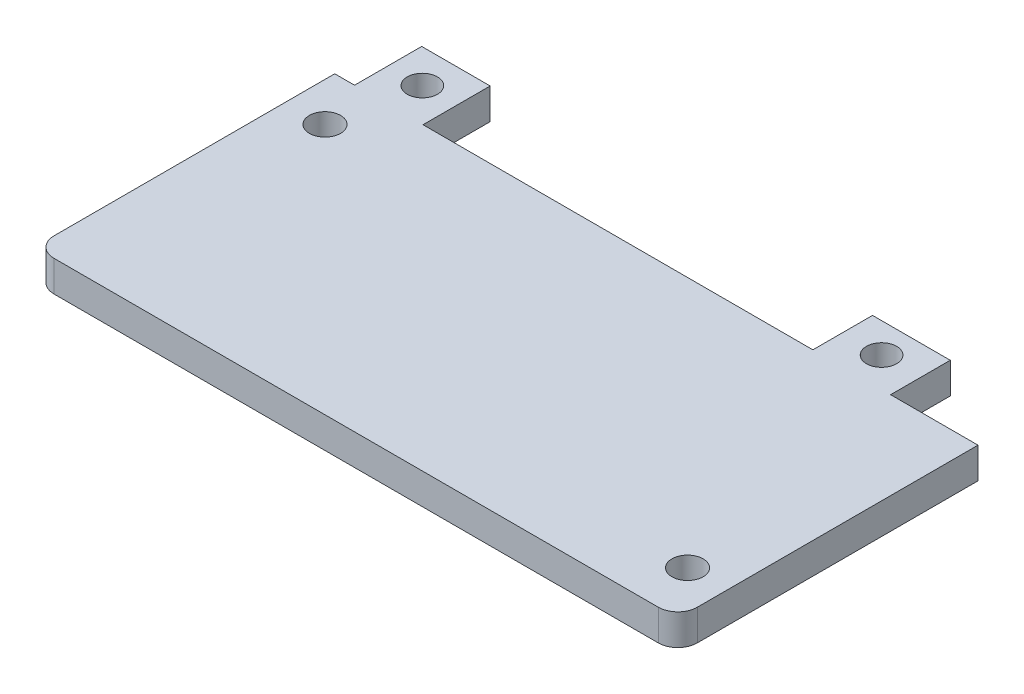
from build123d import *

# Parameters (mm, degrees)
SKETCH2_R           = 1.6
SKETCH2_R_2         = 1.550000008
SKETCH2_R_3         = 1.55
BOSS_EXTRUDE1_DEPTH = 3.175
FILLET1_R           = 2


with BuildPart() as part:
    # Sketch2 → Boss-Extrude1 (new body)
    with BuildSketch(Plane(origin=(0, 0, 0), x_dir=(1, 0, 0), z_dir=(0, 1, 0))):
        Polygon((9.058586069, 30.8), (9.058586069, 37.689356794), (2.033404749, 37.689356794), (2.033404749, 30.8), (0, 30.8), (0, 0), (66, 0), (66, 30.8), (57.033404749, 30.8), (57.033404749, 36.920267815), (49.058586069, 36.920267815), (49.058586069, 30.8), align=None)
        with Locations(Location((62, 5, 0), (0, 0, 270))):
            Circle(SKETCH2_R, mode=Mode.SUBTRACT)
        with Locations(Location((4, 25.8, 0), (0, 0, 270))):
            Circle(SKETCH2_R, mode=Mode.SUBTRACT)
        with Locations(Location((5.545995409, 34.244678397, 0), (0, 0, 270))):
            Circle(SKETCH2_R_2, mode=Mode.SUBTRACT)
        with Locations(Location((53.045995409, 33.860133908, 0), (0, 0, 270))):
            Circle(SKETCH2_R_3, mode=Mode.SUBTRACT)
    extrude(amount=BOSS_EXTRUDE1_DEPTH)

    # Fillet1
    fillet1_edges = [part.edges().sort_by_distance(p)[0] for p in [
        (66, 1.5875, 0),
        (0, 1.5875, 0),
    ]]
    fillet(fillet1_edges, radius=FILLET1_R)


solid = part.part
